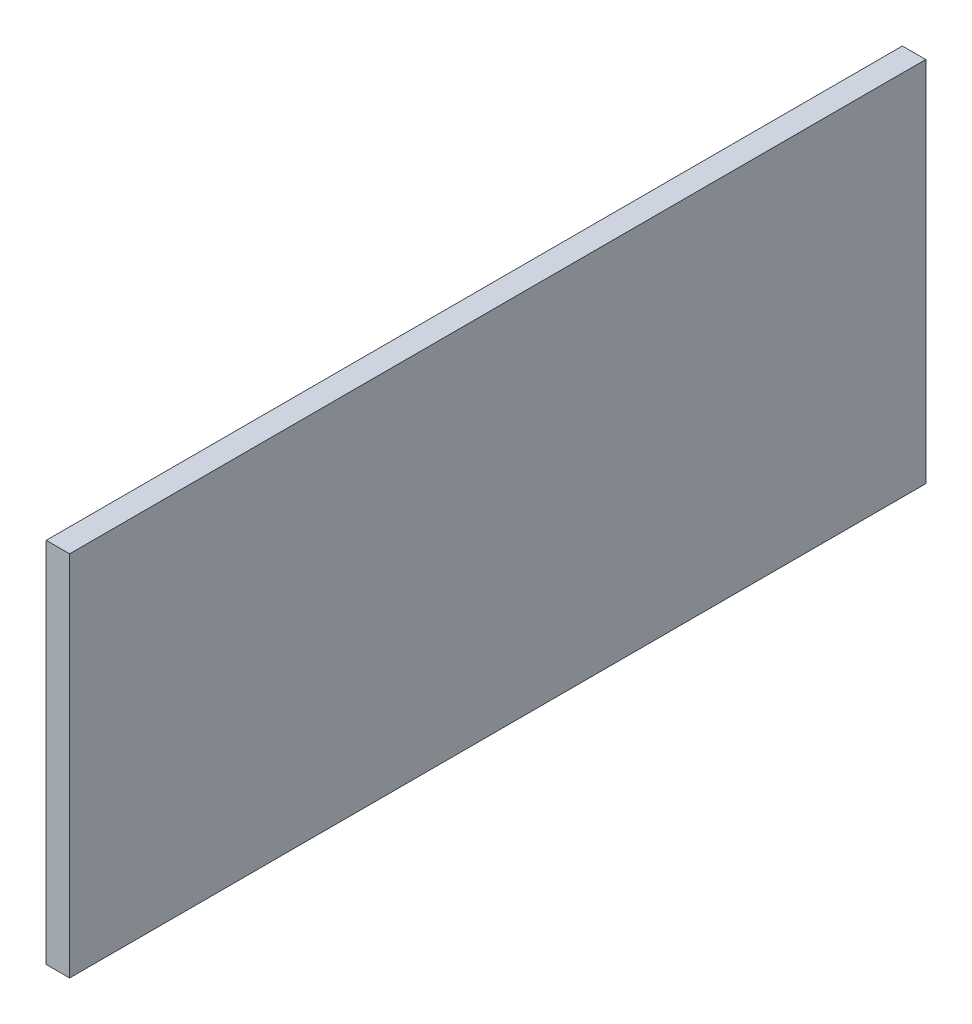
from build123d import *

# Parameters (mm, degrees)
SKETCH1_W           = 6.35
SKETCH1_H           = 99.70008
BOSS_EXTRUDE1_DEPTH = 232.34904


with BuildPart() as part:
    # Sketch1 → Boss-Extrude1 (new body)
    with BuildSketch(Plane.XY):
        Rectangle(SKETCH1_W, SKETCH1_H)
    extrude(amount=BOSS_EXTRUDE1_DEPTH)


solid = part.part
